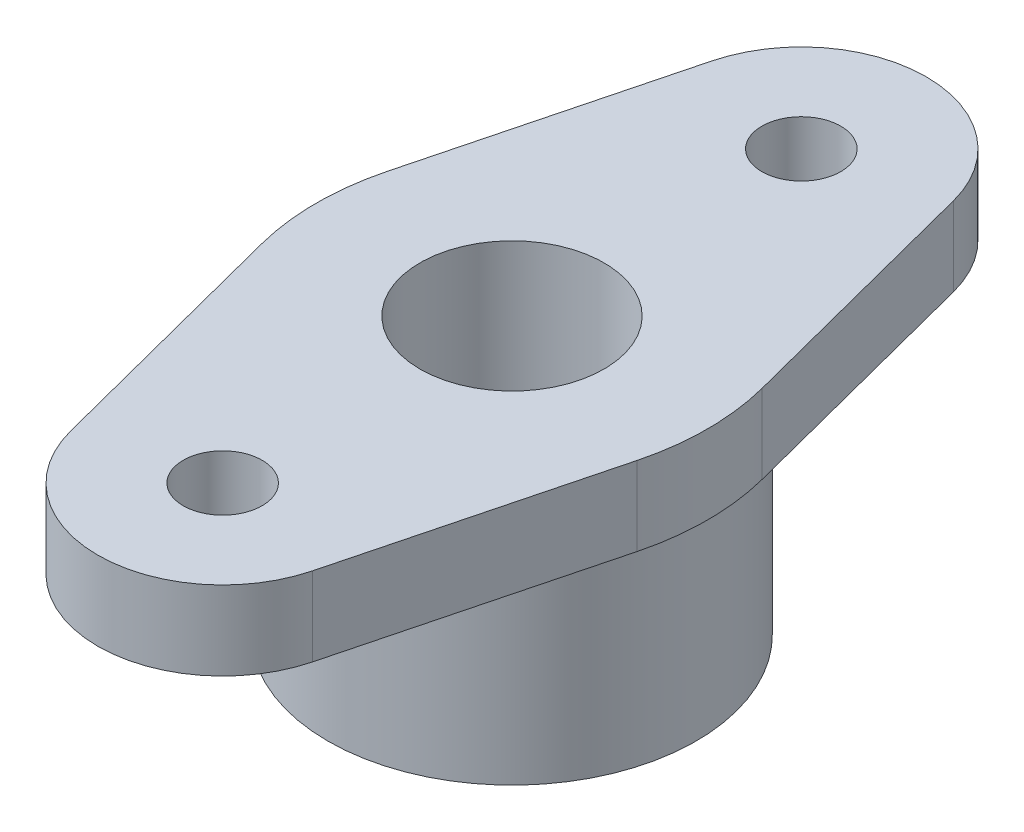
from build123d import *

# Parameters (mm, degrees)
SKETCH2_R           = 14
SKETCH2_R_2         = 19
SKETCH2_R_3         = 6
BOSS_EXTRUDE1_DEPTH = 12
FILLET1_R           = 38


with BuildPart() as part:
    # Sketch2 → Boss-Extrude1 (new body)
    # profile 1 of 3: a face of its own
    with BuildSketch(Plane(origin=(0, 0, 0), x_dir=(1, 0, 0), z_dir=(0, 1, 0))):
        with BuildLine():
            Line((31, 0), (18.395196505, 48.755706629))
            ThreePointArc((18.395196505, 48.755706629), (18.848192667, 46.397005048), (19, 44))
            ThreePointArc((19, 44), (-2.397005048, 25.151807333), (-18.395196505, 48.755706629))
            Line((-18.395196505, 48.755706629), (-31, 0))
            Line((-31, 0), (-18.395196505, -48.755706629))
            ThreePointArc((-18.395196505, -48.755706629), (-2.397005048, -25.151807333), (19, -44))
            ThreePointArc((19, -44), (18.848192667, -46.397005048), (18.395196505, -48.755706629))
            Line((18.395196505, -48.755706629), (31, 0))
        make_face()
        with Locations(Location((0, 0, 0), (0, 0, 270))):
            Circle(SKETCH2_R, mode=Mode.SUBTRACT)
    # profile 2 of 3: a face of its own
    with BuildSketch(Plane(origin=(0, 0, 0), x_dir=(1, 0, 0), z_dir=(0, 1, 0))):
        with Locations((0, -44)):
            Circle(SKETCH2_R_2)
        with Locations(Location((0, -44, 0), (0, 0, 270))):
            Circle(SKETCH2_R_3, mode=Mode.SUBTRACT)
    # profile 3 of 3: a face of its own
    with BuildSketch(Plane(origin=(0, 0, 0), x_dir=(1, 0, 0), z_dir=(0, 1, 0))):
        with Locations((0, 44)):
            Circle(SKETCH2_R_2)
        with Locations(Location((0, 44, 0), (0, 0, 270))):
            Circle(SKETCH2_R_3, mode=Mode.SUBTRACT)
    extrude(amount=BOSS_EXTRUDE1_DEPTH)

    # Fillet1
    fillet1_edges = [part.edges().sort_by_distance(p)[0] for p in [
        (-31, 6, 0),
        (31, 6, 0),
    ]]
    fillet(fillet1_edges, radius=FILLET1_R)

    # Sketch3 → Revolve1 (revolve)
    with BuildSketch(Plane.XY, mode=Mode.PRIVATE) as revolve1_sk:
        Polygon((14, 0), (28, 0), (28, -30), (14, -21.917096231), align=None)
    revolve(revolve1_sk.sketch.rotate(Axis((0, 0, 0), (0, -1, 0)), 90), axis=Axis((0, 0, 0), (0, -1, 0)))


solid = part.part
